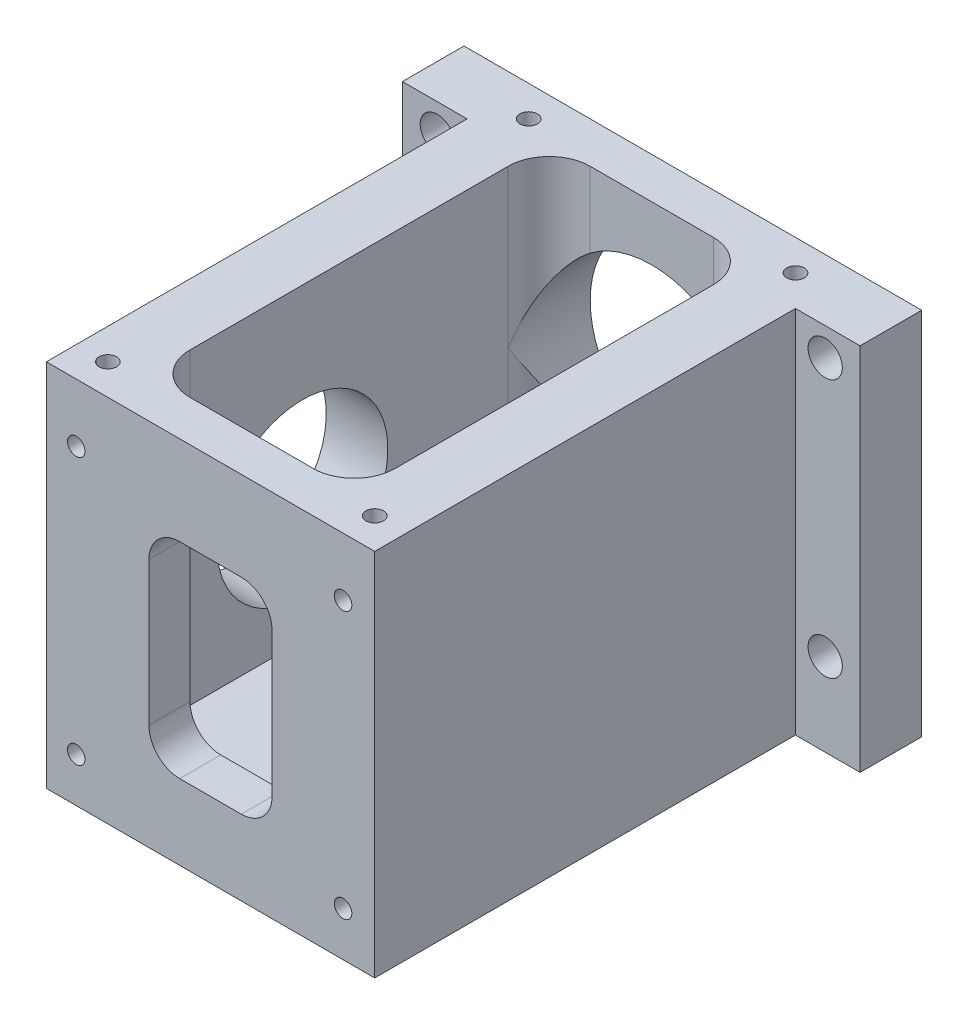
from build123d import *

# Parameters (mm, degrees)
SKETCH1_W                  = 50.8
SKETCH1_H                  = 74.6125
BOSS_EXTRUDE1_DEPTH        = 57.15
SKETCH2_W                  = 31.75
SKETCH2_H                  = 61.9125
CUT_EXTRUDE1_DEPTH         = 47.625
FILLET1_R                  = 6.35
CUT_EXTRUDE2_REACH         = 99.357
SKETCH3_R                  = 15.875
F_6_32_TAPPED_HOLE1_D      = 2.7051
F_6_32_TAPPED_HOLE1_DEPTH  = 7.62
F_6_32_TAPPED_HOLE1_TIP    = 0.81269403
SKETCH8_W                  = 9.525
SKETCH8_H                  = 57.15
BOSS_EXTRUDE2_DEPTH        = 10
M5_CLEARANCE_HOLE1_D       = 5.3
CUT_EXTRUDE3_REACH         = 93.403
SKETCH11_R                 = 13.208
F_10_32_TAPPED_HOLE2_D     = 4.0386
F_10_32_TAPPED_HOLE2_DEPTH = 4.826
F_10_32_TAPPED_HOLE2_TIP   = 1.213317848
F_2_56_TAPPED_HOLE1_D      = 1.778
F_2_56_TAPPED_HOLE1_DEPTH  = 6.604
F_2_56_TAPPED_HOLE1_TIP    = 0.53416509
F_6_32_TAPPED_HOLE2_D      = 2.7051
F_6_32_TAPPED_HOLE2_DEPTH  = 9.0424
F_6_32_TAPPED_HOLE2_TIP    = 0.81269403
CUT_EXTRUDE6_REACH         = 102.431


with BuildPart() as part:
    # Sketch1 → Boss-Extrude1 (new body)
    with BuildSketch(Plane(origin=(0, 0, 0), x_dir=(1, 0, 0), z_dir=(0, 1, 0))):
        Rectangle(SKETCH1_W, SKETCH1_H)
    extrude(amount=BOSS_EXTRUDE1_DEPTH)

    # Sketch2 → Cut-Extrude1 (cut)
    with BuildSketch(Plane(origin=(0, 57.15, 0), x_dir=(1, 0, 0), z_dir=(0, 1, 0))):
        Rectangle(SKETCH2_W, SKETCH2_H)
    extrude(amount=-CUT_EXTRUDE1_DEPTH, mode=Mode.SUBTRACT)

    # Fillet1
    fillet1_edges = [part.edges().sort_by_distance(p)[0] for p in [
        (-15.875, 33.3375, -30.95625),
        (-15.875, 33.3375, 30.95625),
        (15.875, 33.3375, 30.95625),
        (15.875, 33.3375, -30.95625),
    ]]
    fillet(fillet1_edges, radius=FILLET1_R)

    # Sketch3 → Cut-Extrude2 (cut, up to next)
    with BuildSketch(Plane(origin=(0, 0, -37.30625), x_dir=(-1, 0, 0), z_dir=(0, 0, -1)), mode=Mode.PRIVATE) as cut_extrude2_sk1:
        with Locations((0, 32.825)):
            Circle(SKETCH3_R)
    cut_extrude2_tool1 = extrude(cut_extrude2_sk1.sketch, amount=-CUT_EXTRUDE2_REACH, mode=Mode.PRIVATE) & part.part
    add(cut_extrude2_tool1.solids().sort_by_distance((0, 32.825, -37.30625))[0], mode=Mode.SUBTRACT)

    # #6-32 Tapped Hole1
    with Locations(Plane(origin=(0, 57.15, 0), x_dir=(-1, 0, 0), z_dir=(0, 1, 0))):
        with Locations((20.6375, -32.54375), (-20.6375, -32.54375), (20.6375, 32.54375), (-20.6375, 32.54375)):
            Hole(F_6_32_TAPPED_HOLE1_D / 2, depth=F_6_32_TAPPED_HOLE1_DEPTH)
            with Locations((0, 0, -(F_6_32_TAPPED_HOLE1_DEPTH + F_6_32_TAPPED_HOLE1_TIP / 2))):  # 118° drill point
                Cone(0, F_6_32_TAPPED_HOLE1_D / 2, F_6_32_TAPPED_HOLE1_TIP, mode=Mode.SUBTRACT)

    # Sketch8 → Boss-Extrude2 (add)
    with BuildSketch(Plane.ZY.offset(25.4)):
        with Locations((-32.54375, 28.575)):
            Rectangle(SKETCH8_W, SKETCH8_H)
    boss_extrude2 = extrude(amount=BOSS_EXTRUDE2_DEPTH)

    # Mirror1: Boss-Extrude2 across plane
    add(boss_extrude2.mirror(Plane(origin=(0, 0, 0), x_dir=(0, 0, 1), z_dir=(1, 0, 0))))

    # M5 Clearance Hole1 (through all)
    with Locations(Plane(origin=(0, 0, -37.30625), x_dir=(-1, 0, 0), z_dir=(0, 0, -1))):
        with Locations((30, 12.827), (30, 52.827), (-30, 52.827), (-30, 12.827)):
            Hole(M5_CLEARANCE_HOLE1_D / 2)

    # Sketch11 → Cut-Extrude3 (cut, up to next)
    with BuildSketch(Plane.ZY.offset(25.4), mode=Mode.PRIVATE) as cut_extrude3_sk1:
        with Locations((7.20725, 28.575)):
            Circle(SKETCH11_R)
    cut_extrude3_tool1 = extrude(cut_extrude3_sk1.sketch, amount=-CUT_EXTRUDE3_REACH, mode=Mode.PRIVATE) & part.part
    add(cut_extrude3_tool1.solids().sort_by_distance((-25.4, 28.575, 7.20725))[0], mode=Mode.SUBTRACT)

    # #10-32 Tapped Hole2
    with Locations(Plane.ZY.offset(25.4)):
        with Locations((-16.79575, 28.575), (-4.79425, 49.362207767), (19.20875, 49.362207767), (31.21025, 28.575), (19.20875, 7.787792233), (-4.79425, 7.787792233)):
            Hole(F_10_32_TAPPED_HOLE2_D / 2, depth=F_10_32_TAPPED_HOLE2_DEPTH)
            with Locations((0, 0, -(F_10_32_TAPPED_HOLE2_DEPTH + F_10_32_TAPPED_HOLE2_TIP / 2))):  # 118° drill point
                Cone(0, F_10_32_TAPPED_HOLE2_D / 2, F_10_32_TAPPED_HOLE2_TIP, mode=Mode.SUBTRACT)

    # #2-56 Tapped Hole1
    with Locations(Plane(origin=(0, 9.525, 0), x_dir=(-1, 0, 0), z_dir=(0, 1, 0))):
        with Locations((13, -12.163354521), (13, -25.163354521), (-13, -25.163354521), (-13, -12.163354521), (5.6515, 4.74375), (-5.6515, 4.74375)):
            Hole(F_2_56_TAPPED_HOLE1_D / 2, depth=F_2_56_TAPPED_HOLE1_DEPTH)
            with Locations((0, 0, -(F_2_56_TAPPED_HOLE1_DEPTH + F_2_56_TAPPED_HOLE1_TIP / 2))):  # 118° drill point
                Cone(0, F_2_56_TAPPED_HOLE1_D / 2, F_2_56_TAPPED_HOLE1_TIP, mode=Mode.SUBTRACT)

    # #6-32 Tapped Hole2
    with Locations(Plane.XY.offset(37.30625)):
        with Locations((20.50625, 48.141034847), (20.50625, 6.866034847), (-20.76875, 48.141034847), (-20.76875, 6.866034847)):
            Hole(F_6_32_TAPPED_HOLE2_D / 2, depth=F_6_32_TAPPED_HOLE2_DEPTH)
            with Locations((0, 0, -(F_6_32_TAPPED_HOLE2_DEPTH + F_6_32_TAPPED_HOLE2_TIP / 2))):  # 118° drill point
                Cone(0, F_6_32_TAPPED_HOLE2_D / 2, F_6_32_TAPPED_HOLE2_TIP, mode=Mode.SUBTRACT)

    # Sketch24 → Cut-Extrude6 (cut, up to next)
    with BuildSketch(Plane.XY.offset(37.30625), mode=Mode.PRIVATE) as cut_extrude6_sk1:
        with BuildLine():
            Line((-4.7625, 11.628534847), (4.7625, 11.628534847))
            ThreePointArc((4.7625, 11.628534847), (8.130096045, 13.023438801), (9.525, 16.391034847))
            Line((9.525, 16.391034847), (9.525, 38.616034847))
            ThreePointArc((9.525, 38.616034847), (8.130096045, 41.983630892), (4.7625, 43.378534847))
            Line((4.7625, 43.378534847), (-4.7625, 43.378534847))
            ThreePointArc((-4.7625, 43.378534847), (-8.130096045, 41.983630892), (-9.525, 38.616034847))
            Line((-9.525, 38.616034847), (-9.525, 16.391034847))
            ThreePointArc((-9.525, 16.391034847), (-8.130096045, 13.023438801), (-4.7625, 11.628534847))
        make_face()
    cut_extrude6_tool1 = extrude(cut_extrude6_sk1.sketch, amount=-CUT_EXTRUDE6_REACH, mode=Mode.PRIVATE) & part.part
    add(cut_extrude6_tool1.solids().sort_by_distance((0, 27.503535, 37.30625))[0], mode=Mode.SUBTRACT)


solid = part.part
